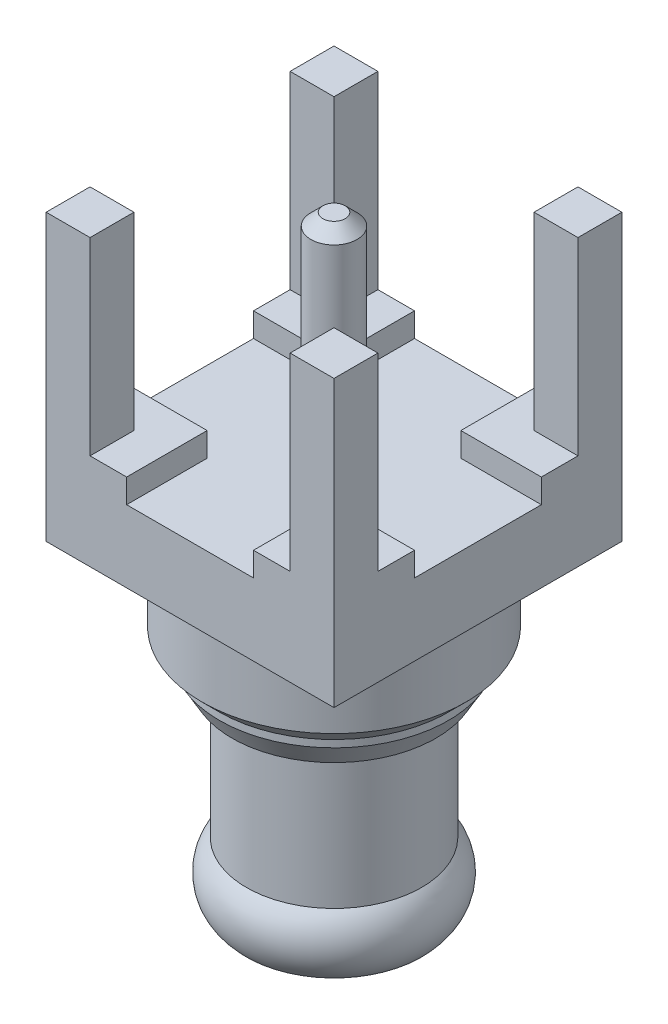
from build123d import *

# Parameters (mm, degrees)
SKETCH1_W           = 5.9944
SKETCH1_H           = 5.9944
BOSS_EXTRUDE1_DEPTH = 1.5
SKETCH2_W           = 1.6764
SKETCH2_H           = 1.6764
BOSS_EXTRUDE2_DEPTH = 0.5
SKETCH3_W           = 0.9144
SKETCH3_H           = 0.9144
BOSS_EXTRUDE3_DEPTH = 3.937
SKETCH4_R           = 2.7472
SKETCH4_R_2         = 1.3208
BOSS_EXTRUDE4_DEPTH = 6.5852
CHAMFER1_SIZE       = 0.125
SKETCH7_R           = 0.4826
BOSS_EXTRUDE5_DEPTH = 4.437
CHAMFER2_SIZE       = 0.25


with BuildPart() as part:
    # Sketch1 → Boss-Extrude1 (new body)
    with BuildSketch(Plane(origin=(0, 0, 0), x_dir=(1, 0, 0), z_dir=(0, 1, 0))):
        Rectangle(SKETCH1_W, SKETCH1_H)
    extrude(amount=BOSS_EXTRUDE1_DEPTH)

    # Sketch2 → Boss-Extrude2 (add)
    with BuildSketch(Plane(origin=(0, 1.5, 0), x_dir=(1, 0, 0), z_dir=(0, 1, 0))):
        with Locations((-2.159, 2.159)):
            Rectangle(SKETCH2_W, SKETCH2_H)
        with Locations((2.159, 2.159)):
            Rectangle(SKETCH2_W, SKETCH2_H)
        with Locations((2.159, -2.159)):
            Rectangle(SKETCH2_W, SKETCH2_H)
        with Locations((-2.159, -2.159)):
            Rectangle(SKETCH2_W, SKETCH2_H)
    extrude(amount=BOSS_EXTRUDE2_DEPTH)

    # Sketch3 → Boss-Extrude3 (add)
    with BuildSketch(Plane(origin=(0, 2, 0), x_dir=(1, 0, 0), z_dir=(0, 1, 0))):
        with Locations((-2.54, -2.54)):
            Rectangle(SKETCH3_W, SKETCH3_H)
        with Locations((2.54, -2.54)):
            Rectangle(SKETCH3_W, SKETCH3_H)
        with Locations((2.54, 2.54)):
            Rectangle(SKETCH3_W, SKETCH3_H)
        with Locations((-2.54, 2.54)):
            Rectangle(SKETCH3_W, SKETCH3_H)
    extrude(amount=BOSS_EXTRUDE3_DEPTH)

    # Sketch4 → Boss-Extrude4 (add)
    with BuildSketch(Plane.XZ):
        with Locations(Location((0, 0, 0), (0, 0, 90))):
            Circle(SKETCH4_R)
        with Locations(Location((0, 0, 0), (0, 0, 90))):
            Circle(SKETCH4_R_2, mode=Mode.SUBTRACT)
    extrude(amount=BOSS_EXTRUDE4_DEPTH)

    # Chamfer1
    chamfer1_edges = [part.edges().sort_by_distance(p)[0] for p in [
        (0, -6.5852, -1.3208),
        (0, -6.5852, -2.7472),
    ]]
    chamfer(chamfer1_edges, length=CHAMFER1_SIZE)

    # Sketch5 → Cut-Revolve1 (revolve, cut)
    with BuildSketch(Plane.XY, mode=Mode.PRIVATE) as cut_revolve1_sk:
        with BuildLine():
            Line((-2.7472, 0), (-2.7472, -1.524))
            Line((-2.7472, -1.524), (-2.3828, -1.8884))
            Line((-2.3828, -1.8884), (-2.3828, -2.0384))
            Line((-2.3828, -2.0384), (-2.122992379, -2.4884))
            Line((-2.122992379, -2.4884), (-1.822992379, -2.4884))
            Line((-1.822992379, -2.4884), (-1.822992379, -5.330737835))
            ThreePointArc((-1.822992379, -5.330737835), (-2.0828, -5.957968917), (-1.822992379, -6.5852))
            Line((-1.822992379, -6.5852), (-3.193096247, -6.5852))
            Line((-3.193096247, -6.5852), (-3.193096247, 0))
            Line((-3.193096247, 0), (-2.7472, 0))
        make_face()
    revolve(cut_revolve1_sk.sketch.rotate(Axis((0, -6.4602, 0), (0, 1, 0)), 270), axis=Axis((0, -6.4602, 0), (0, 1, 0)), mode=Mode.SUBTRACT)

    # Sketch7 → Boss-Extrude5 (add)
    with BuildSketch(Plane(origin=(0, 1.5, 0), x_dir=(1, 0, 0), z_dir=(0, 1, 0))):
        with Locations(Location((0, 0, 0), (0, 0, 90))):
            Circle(SKETCH7_R)
    extrude(amount=BOSS_EXTRUDE5_DEPTH)

    # Chamfer2
    chamfer2_edges = [part.edges().sort_by_distance(p)[0] for p in [
        (0, 5.937, 0.4826),
    ]]
    chamfer(chamfer2_edges, length=CHAMFER2_SIZE)


solid = part.part
